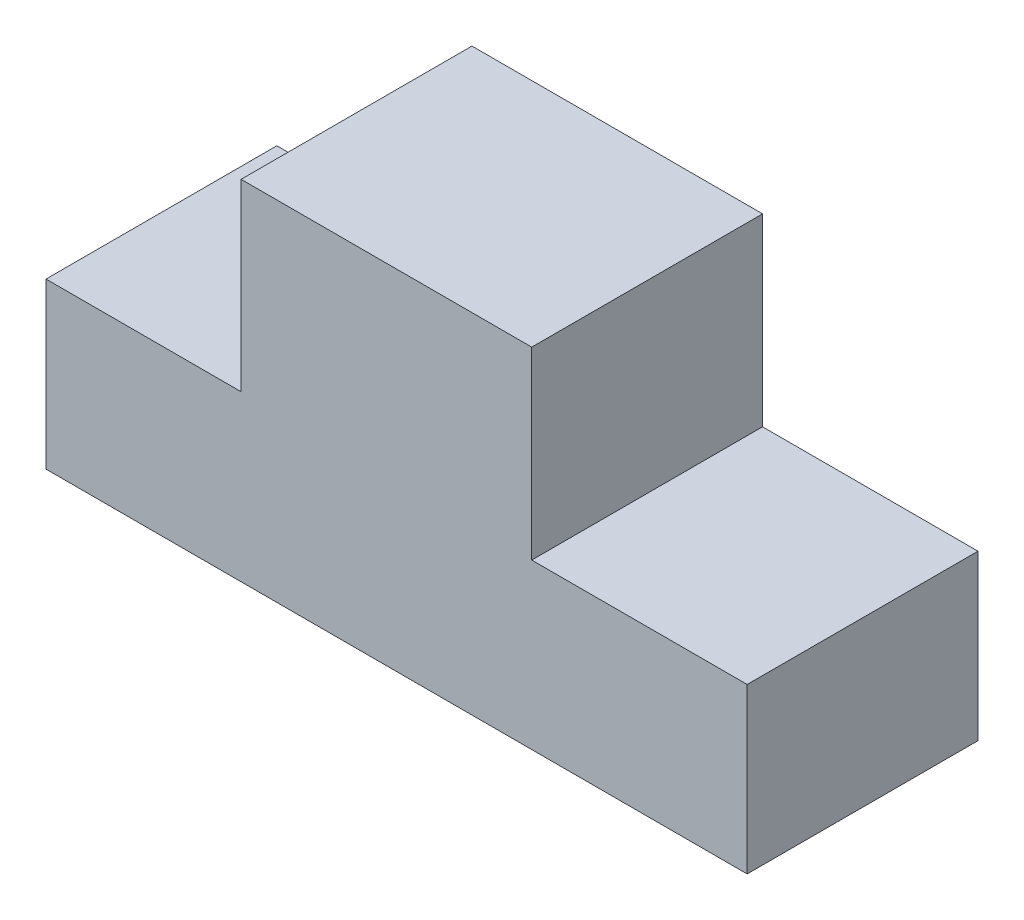
from build123d import *

# Parameters (mm, degrees)
Y_KSEKLIK_EKSTR_ZYON1_DEPTH = 85


with BuildPart() as part:
    # Çizim1 → Yükseklik-Ekstrüzyon1 (new body)
    with BuildSketch(Plane.XY):
        Polygon((-58.128268518, 67.913084922), (48.886289541, 67.913084922), (48.886289541, 0), (128.211766144, 0), (128.211766144, -60.429549393), (32.796688154, -60.429549393), (-37.174369038, -60.429549393), (-129.970209593, -60.429549393), (-129.970209593, 0.187088388), (-58.128268518, 0.187088388), align=None)
    extrude(amount=Y_KSEKLIK_EKSTR_ZYON1_DEPTH)


solid = part.part
